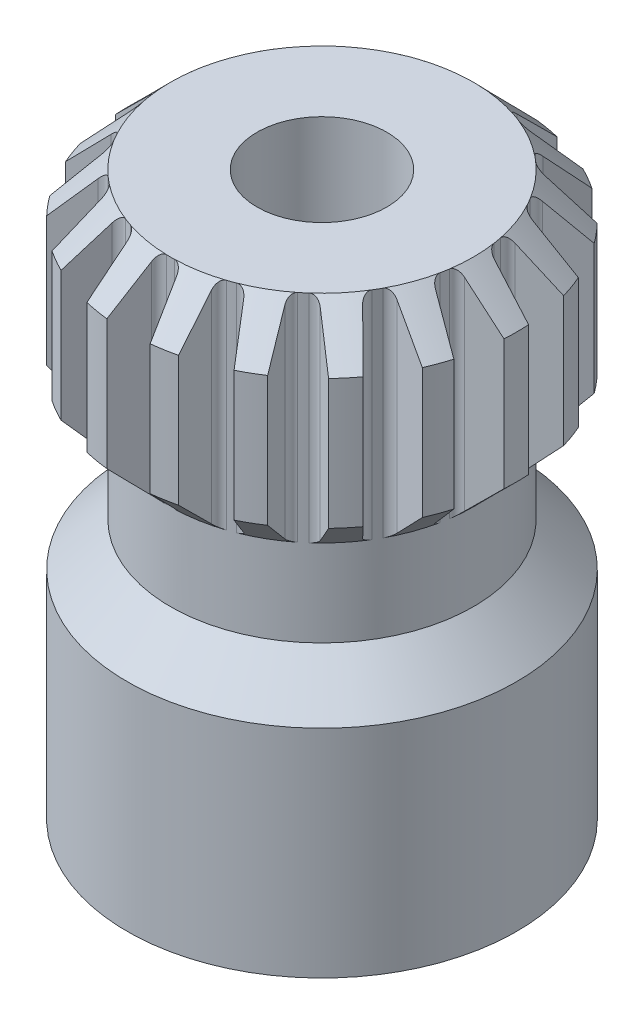
from build123d import *

# Parameters (mm, degrees)
SKETCH1_R           = 2.25
BOSS_EXTRUDE1_DEPTH = 6.5
SKETCH3_R           = 0.75
CUT_EXTRUDE1_DEPTH  = 8.237057413
CUT_EXTRUDE2_REACH  = 9.237
CIRPATTERN1_COUNT   = 18


with BuildPart() as part:
    # Sketch1 → Boss-Extrude1 (new body)
    with BuildSketch(Plane(origin=(0, 0, 0), x_dir=(1, 0, 0), z_dir=(0, 1, 0))):
        with Locations(Location((0, 0, 0), (0, 0, 90))):
            Circle(SKETCH1_R)
    extrude(amount=BOSS_EXTRUDE1_DEPTH)

    # Sketch2 → Cut-Revolve1 (revolve, cut)
    with BuildSketch(Plane.XY, mode=Mode.PRIVATE) as cut_revolve1_sk:
        Polygon((-2.25, 2.5), (-1.75, 3), (-1.75, 4), (-2.25, 4.5), (-2.25, 4), align=None)
        Polygon((-2.25, 6.5), (-2.25, 6), (-1.75, 6.5), align=None)
    revolve(cut_revolve1_sk.sketch.rotate(Axis((0, 0, 0), (0, 1, 0)), 270), axis=Axis((0, 0, 0), (0, 1, 0)), mode=Mode.SUBTRACT)

    # Sketch3 → Cut-Extrude1 (cut, through all)
    with BuildSketch(Plane(origin=(0, 6.5, 0), x_dir=(1, 0, 0), z_dir=(0, 1, 0))):
        with Locations(Location((0, 0, 0), (0, 0, 270))):
            Circle(SKETCH3_R)
    extrude(amount=-CUT_EXTRUDE1_DEPTH, mode=Mode.SUBTRACT)

    # Cut-Extrude2: up to this cone (the profile starts inside it)
    cut_extrude2_end = Plane(origin=(0, 6.5, 0), z_dir=(0, 1, 0)).offset(-4.249999) * Cone(1e-06, 18.237, 18.236999, align=(Align.CENTER, Align.CENTER, Align.MIN), mode=Mode.PRIVATE)
    # Sketch4 → Cut-Extrude2 (cut, up to the surface)
    with BuildSketch(Plane(origin=(0, 6.5, 0), x_dir=(1, 0, 0), z_dir=(0, 1, 0)), mode=Mode.PRIVATE) as cut_extrude2_sk1:
        with BuildLine():
            Line((-0.25, 2.236067977), (-0.145168461, 1.824677172))
            ThreePointArc((-0.145168461, 1.824677172), (-0.108592246, 1.769616655), (-0.045656232, 1.74940433))
            ThreePointArc((-0.045656232, 1.74940433), (0, 1.75), (0.045656232, 1.74940433))
            ThreePointArc((0.045656232, 1.74940433), (0.108592246, 1.769616655), (0.145168461, 1.824677172))
            Line((0.145168461, 1.824677172), (0.25, 2.236067977))
            ThreePointArc((0.25, 2.236067977), (0, 2.25), (-0.25, 2.236067977))
        make_face()
    cut_extrude2_tool1 = extrude(cut_extrude2_sk1.sketch, amount=-CUT_EXTRUDE2_REACH, mode=Mode.PRIVATE) & cut_extrude2_end
    cut_extrude2 = cut_extrude2_tool1.solids().sort_by_distance((0, 6.5, -2.028298))[0]
    add(cut_extrude2, mode=Mode.SUBTRACT)

    # CirPattern1: Cut-Extrude2 ×18 about axis
    cirpattern1_axis = Axis((0, 0, 0), (0, 1, 0))
    for i in range(1, CIRPATTERN1_COUNT):
        add(cut_extrude2.rotate(cirpattern1_axis, i * 360 / CIRPATTERN1_COUNT), mode=Mode.SUBTRACT)


solid = part.part
